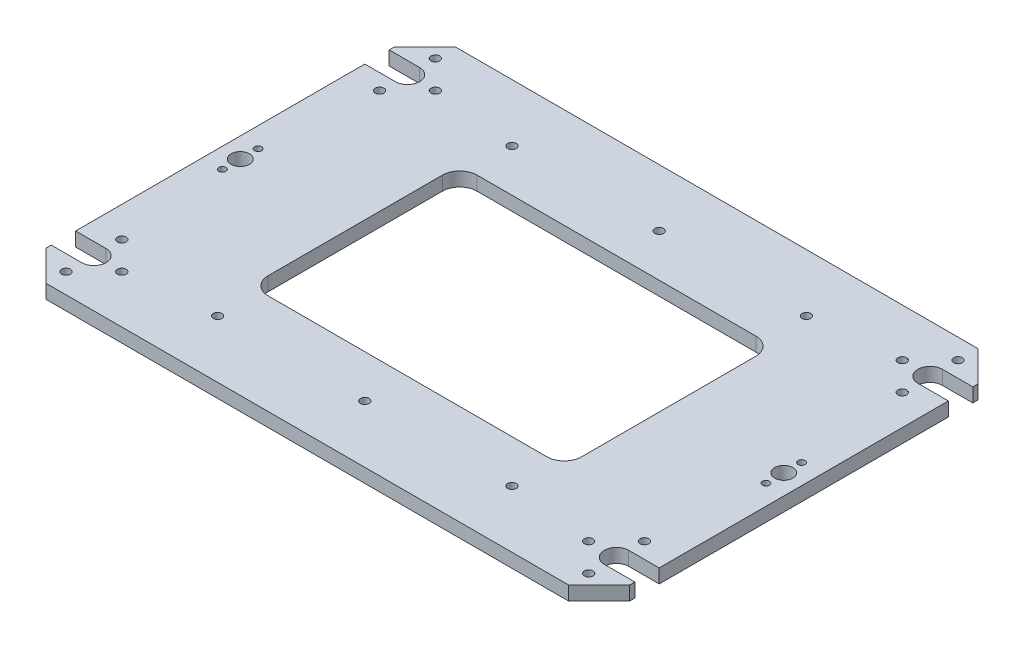
from build123d import *

# Parameters (mm, degrees)
SKETCH1_R           = 5.25
SKETCH1_R_2         = 2
SKETCH1_R_3         = 2.5
BOSS_EXTRUDE1_DEPTH = 8


with BuildPart() as part:
    # Sketch1 → Boss-Extrude1 (new body)
    with BuildSketch(Plane(origin=(0, 0, 0), x_dir=(1, 0, 0), z_dir=(0, 1, 0))):
        with BuildLine():
            Line((-167.5, -100), (-150, -117.5))
            Line((-150, -117.5), (150, -117.5))
            Line((150, -117.5), (167.5, -100))
            Line((167.5, -100), (167.5, -97))
            Line((167.5, -97), (150, -97))
            ThreePointArc((150, -97), (143, -90), (150, -83))
            Line((150, -83), (167.5, -83))
            Line((167.5, -83), (167.5, 83))
            Line((167.5, 83), (150, 83))
            ThreePointArc((150, 83), (143, 90), (150, 97))
            Line((150, 97), (167.5, 97))
            Line((167.5, 97), (167.5, 100))
            Line((167.5, 100), (150, 117.5))
            Line((150, 117.5), (-150, 117.5))
            Line((-150, 117.5), (-167.5, 100))
            Line((-167.5, 100), (-167.5, 97))
            Line((-167.5, 97), (-150, 97))
            ThreePointArc((-150, 97), (-143, 90), (-150, 83))
            Line((-150, 83), (-167.5, 83))
            Line((-167.5, 83), (-167.5, -83))
            Line((-167.5, -83), (-150, -83))
            ThreePointArc((-150, -83), (-143, -90), (-150, -97))
            Line((-150, -97), (-167.5, -97))
            Line((-167.5, -97), (-167.5, -100))
        make_face()
        with Locations(Location((-156, 0, 0), (0, 0, 270))):
            Circle(SKETCH1_R, mode=Mode.SUBTRACT)
        with Locations(Location((-156, -10.246017435, 0), (0, 0, 270))):
            Circle(SKETCH1_R_2, mode=Mode.SUBTRACT)
        with Locations(Location((-84.5, 84.5, 0), (0, 0, 270))):
            Circle(SKETCH1_R_3, mode=Mode.SUBTRACT)
        with Locations(Location((0, 84.5, 0), (0, 0, 270))):
            Circle(SKETCH1_R_3, mode=Mode.SUBTRACT)
        with Locations(Location((84.5, 84.5, 0), (0, 0, 270))):
            Circle(SKETCH1_R_3, mode=Mode.SUBTRACT)
        with Locations(Location((84.5, -84.5, 0), (0, 0, 270))):
            Circle(SKETCH1_R_3, mode=Mode.SUBTRACT)
        with Locations(Location((0, -84.5, 0), (0, 0, 270))):
            Circle(SKETCH1_R_3, mode=Mode.SUBTRACT)
        with Locations(Location((-84.5, -84.5, 0), (0, 0, 270))):
            Circle(SKETCH1_R_3, mode=Mode.SUBTRACT)
        with Locations(Location((-156, 10.246017435, 0), (0, 0, 90))):
            Circle(SKETCH1_R_2, mode=Mode.SUBTRACT)
        with Locations(Location((156, 10.246017435, 0), (0, 0, 270))):
            Circle(SKETCH1_R_2, mode=Mode.SUBTRACT)
        with Locations(Location((156, -10.246017435, 0), (0, 0, 90))):
            Circle(SKETCH1_R_2, mode=Mode.SUBTRACT)
        with Locations(Location((156, 0, 0), (0, 0, 90))):
            Circle(SKETCH1_R, mode=Mode.SUBTRACT)
        with Locations(Location((-150, -74, 0), (0, 0, 270))):
            Circle(SKETCH1_R_3, mode=Mode.SUBTRACT)
        with Locations(Location((-134, -90, 0), (0, 0, 270))):
            Circle(SKETCH1_R_3, mode=Mode.SUBTRACT)
        with Locations(Location((-150, -106, 0), (0, 0, 270))):
            Circle(SKETCH1_R_3, mode=Mode.SUBTRACT)
        with Locations(Location((-150, 74, 0), (0, 0, 90))):
            Circle(SKETCH1_R_3, mode=Mode.SUBTRACT)
        with Locations(Location((-134, 90, 0), (0, 0, 90))):
            Circle(SKETCH1_R_3, mode=Mode.SUBTRACT)
        with Locations(Location((-150, 106, 0), (0, 0, 90))):
            Circle(SKETCH1_R_3, mode=Mode.SUBTRACT)
        with Locations(Location((150, -74, 0), (0, 0, 90))):
            Circle(SKETCH1_R_3, mode=Mode.SUBTRACT)
        with Locations(Location((134, -90, 0), (0, 0, 90))):
            Circle(SKETCH1_R_3, mode=Mode.SUBTRACT)
        with Locations(Location((150, -106, 0), (0, 0, 90))):
            Circle(SKETCH1_R_3, mode=Mode.SUBTRACT)
        with Locations(Location((150, 106, 0), (0, 0, 270))):
            Circle(SKETCH1_R_3, mode=Mode.SUBTRACT)
        with Locations(Location((150, 74, 0), (0, 0, 270))):
            Circle(SKETCH1_R_3, mode=Mode.SUBTRACT)
        with Locations(Location((134, 90, 0), (0, 0, 270))):
            Circle(SKETCH1_R_3, mode=Mode.SUBTRACT)
        with BuildLine():
            Line((-80, -60), (80, -60))
            ThreePointArc((80, -60), (87.071067812, -57.071067812), (90, -50))
            Line((90, -50), (90, 50))
            ThreePointArc((90, 50), (87.071067812, 57.071067812), (80, 60))
            Line((80, 60), (-80, 60))
            ThreePointArc((-80, 60), (-87.071067812, 57.071067812), (-90, 50))
            Line((-90, 50), (-90, -50))
            ThreePointArc((-90, -50), (-87.071067812, -57.071067812), (-80, -60))
        make_face(mode=Mode.SUBTRACT)
    extrude(amount=BOSS_EXTRUDE1_DEPTH)


solid = part.part
